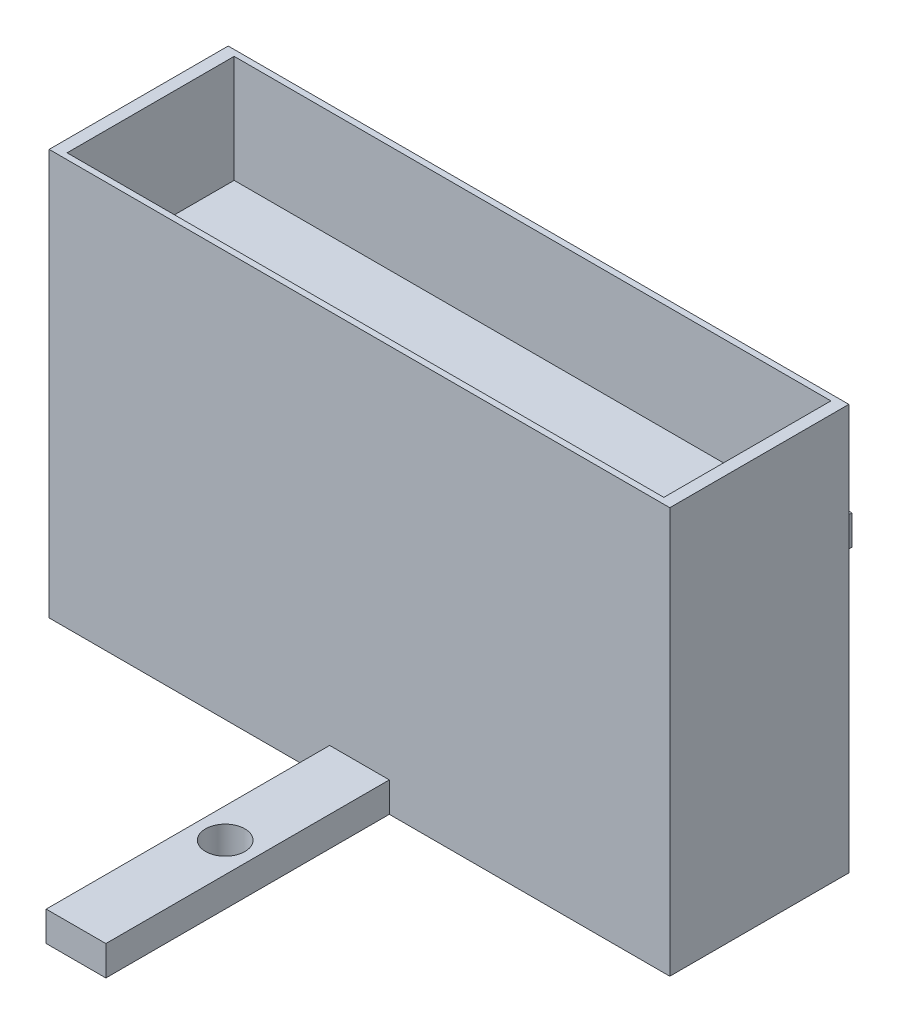
from build123d import *

# Parameters (mm, degrees)
SKETCH2_W           = 104
SKETCH2_H           = 30
BOSS_EXTRUDE1_DEPTH = 68
SKETCH3_W           = 100
SKETCH3_H           = 28
CUT_EXTRUDE1_DEPTH  = 18
SKETCH4_W           = 10
SKETCH4_H           = 47.5
BOSS_EXTRUDE3_DEPTH = 5
SKETCH7_W           = 3.3
SKETCH7_H           = 5
SKETCH13_W          = 10
SKETCH13_H          = 47.5
BOSS_EXTRUDE4_DEPTH = 5
SKETCH14_W          = 3.3
SKETCH14_H          = 5


with BuildPart() as part:
    # Sketch2 → Boss-Extrude1 (new body)
    with BuildSketch(Plane(origin=(0, 0, 0), x_dir=(1, 0, 0), z_dir=(0, 1, 0))):
        Rectangle(SKETCH2_W, SKETCH2_H)
    extrude(amount=BOSS_EXTRUDE1_DEPTH)

    # Sketch3 → Cut-Extrude1 (cut)
    with BuildSketch(Plane(origin=(0, 68, 0), x_dir=(1, 0, 0), z_dir=(0, 1, 0))):
        Rectangle(SKETCH3_W, SKETCH3_H)
    extrude(amount=-CUT_EXTRUDE1_DEPTH, mode=Mode.SUBTRACT)


with BuildPart() as body_2:
    # Sketch4 → Boss-Extrude3 (new body)
    with BuildSketch(Plane(origin=(0, 0, 0), x_dir=(-1, 0, 0), z_dir=(0, -1, 0))):
        with Locations((0, -38.75)):
            Rectangle(SKETCH4_W, SKETCH4_H)
    extrude(amount=-BOSS_EXTRUDE3_DEPTH)

    # Sketch7 → M6 Clearance Hole1 (revolve, cut)
    with BuildSketch(Plane(origin=(0, 5, 37.5), x_dir=(0, 0, 1), z_dir=(1, 0, 0))):
        with Locations((1.65, 2.5)):
            Rectangle(SKETCH7_W, SKETCH7_H)
    revolve(axis=Axis((0, 11.35, 37.5), (0, -1, 0)), mode=Mode.SUBTRACT)


with BuildPart() as body_3:
    # Sketch13 → Boss-Extrude4 (new body)
    with BuildSketch(Plane(origin=(0, 0, 0), x_dir=(-1, 0, 0), z_dir=(0, -1, 0))):
        with Locations((0, 38.75)):
            Rectangle(SKETCH13_W, SKETCH13_H)
    extrude(amount=-BOSS_EXTRUDE4_DEPTH)

    # Sketch14 → M6 Clearance Hole2 (revolve, cut)
    with BuildSketch(Plane(origin=(0, 5, -37.5), x_dir=(0, 0, 1), z_dir=(1, 0, 0))):
        with Locations((1.65, 2.5)):
            Rectangle(SKETCH14_W, SKETCH14_H)
    revolve(axis=Axis((0, 11.35, -37.5), (0, -1, 0)), mode=Mode.SUBTRACT)


solid = Compound([part.part, body_2.part, body_3.part])
